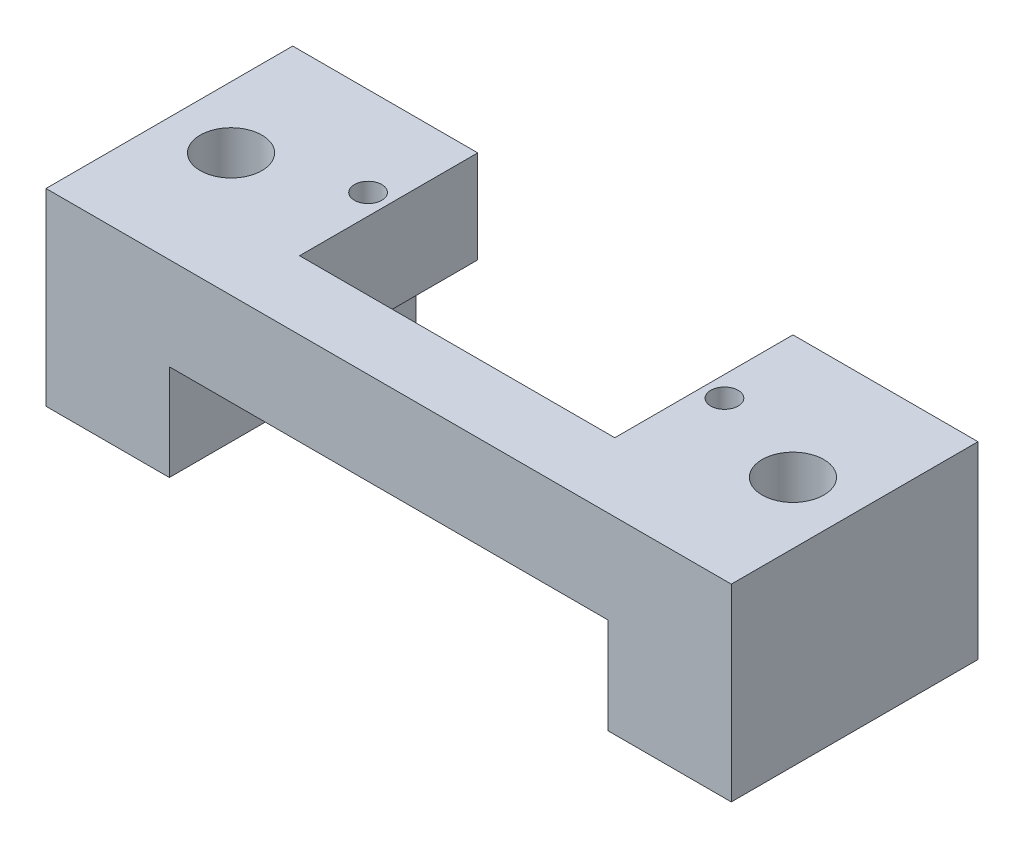
from build123d import *

# Parameters (mm, degrees)
SKETCH1_W           = 50
SKETCH1_H           = 18
BOSS_EXTRUDE2_DEPTH = 22
SKETCH4_W           = 32
SKETCH4_H           = 14
CUT_EXTRUDE1_DEPTH  = 58.515215378
SKETCH5_W           = 23
SKETCH5_H           = 18
CUT_EXTRUDE3_DEPTH  = 13
SKETCH7_W           = 50
SKETCH7_H           = 8.235017036
CUT_EXTRUDE4_DEPTH  = 58.515215378
SKETCH9_R           = 1
CUT_EXTRUDE6_DEPTH  = 54.600373133
SKETCH10_R          = 2.25
CUT_EXTRUDE7_DEPTH  = 55.895125066


with BuildPart() as part:
    # Sketch1 → Boss-Extrude2 (new body)
    with BuildSketch(Plane(origin=(0, 0, 0), x_dir=(1, 0, 0), z_dir=(0, 1, 0))):
        with Locations((25, 9)):
            Rectangle(SKETCH1_W, SKETCH1_H)
    extrude(amount=BOSS_EXTRUDE2_DEPTH)

    # Sketch4 → Cut-Extrude1 (cut, through all)
    with BuildSketch(Plane.XY):
        with Locations((25, 0)):
            Rectangle(SKETCH4_W, SKETCH4_H)
    extrude(amount=-CUT_EXTRUDE1_DEPTH, mode=Mode.SUBTRACT)

    # Sketch5 → Cut-Extrude3 (cut)
    with BuildSketch(Plane(origin=(0, 0, -18), x_dir=(-1, 0, 0), z_dir=(0, 0, -1))):
        with Locations((-25, 7)):
            Rectangle(SKETCH5_W, SKETCH5_H)
    extrude(amount=-CUT_EXTRUDE3_DEPTH, mode=Mode.SUBTRACT)

    # Sketch7 → Cut-Extrude4 (cut, through all)
    with BuildSketch(Plane(origin=(0, 0, -18), x_dir=(-1, 0, 0), z_dir=(0, 0, -1))):
        with Locations((-25, 17.882491482)):
            Rectangle(SKETCH7_W, SKETCH7_H)
    extrude(amount=-CUT_EXTRUDE4_DEPTH, mode=Mode.SUBTRACT)

    # Sketch9 → Cut-Extrude6 (cut, through all)
    with BuildSketch(Plane.XZ.offset(-7)):
        with Locations(Location((12, -11.5, 0), (0, 0, 270))):
            Circle(SKETCH9_R)
        with Locations(Location((38, -11.5, 0), (0, 0, 90))):
            Circle(SKETCH9_R)
    extrude(amount=-CUT_EXTRUDE6_DEPTH, mode=Mode.SUBTRACT)

    # Sketch10 → Cut-Extrude7 (cut, through all)
    with BuildSketch(Plane(origin=(0, 13.764982964, 0), x_dir=(1, 0, 0), z_dir=(0, 1, 0))):
        with Locations(Location((4.5, 9, 0), (0, 0, 270))):
            Circle(SKETCH10_R)
        with Locations(Location((45.5, 9, 0), (0, 0, 90))):
            Circle(SKETCH10_R)
    extrude(amount=-CUT_EXTRUDE7_DEPTH, mode=Mode.SUBTRACT)


solid = part.part
